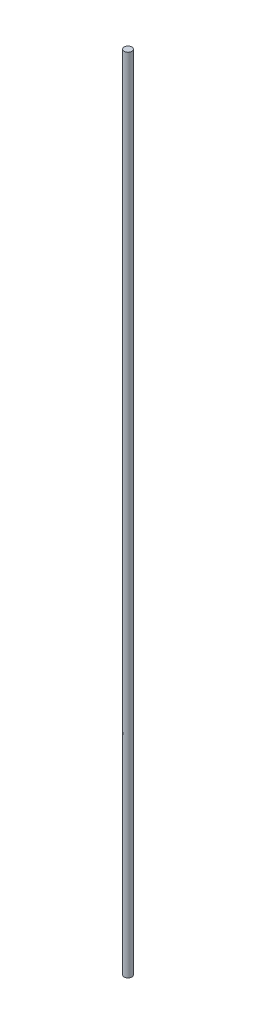
from build123d import *

# Parameters (mm, degrees)
SKETCH1_R           = 1.65
BOSS_EXTRUDE1_DEPTH = 344


with BuildPart() as part:
    # Sketch1 → Boss-Extrude1 (new body)
    with BuildSketch(Plane(origin=(0, 0, 0), x_dir=(1, 0, 0), z_dir=(0, 1, 0))):
        with Locations(Location((0, 0, 0), (0, 0, 270))):
            Circle(SKETCH1_R)
    extrude(amount=BOSS_EXTRUDE1_DEPTH)


solid = part.part
